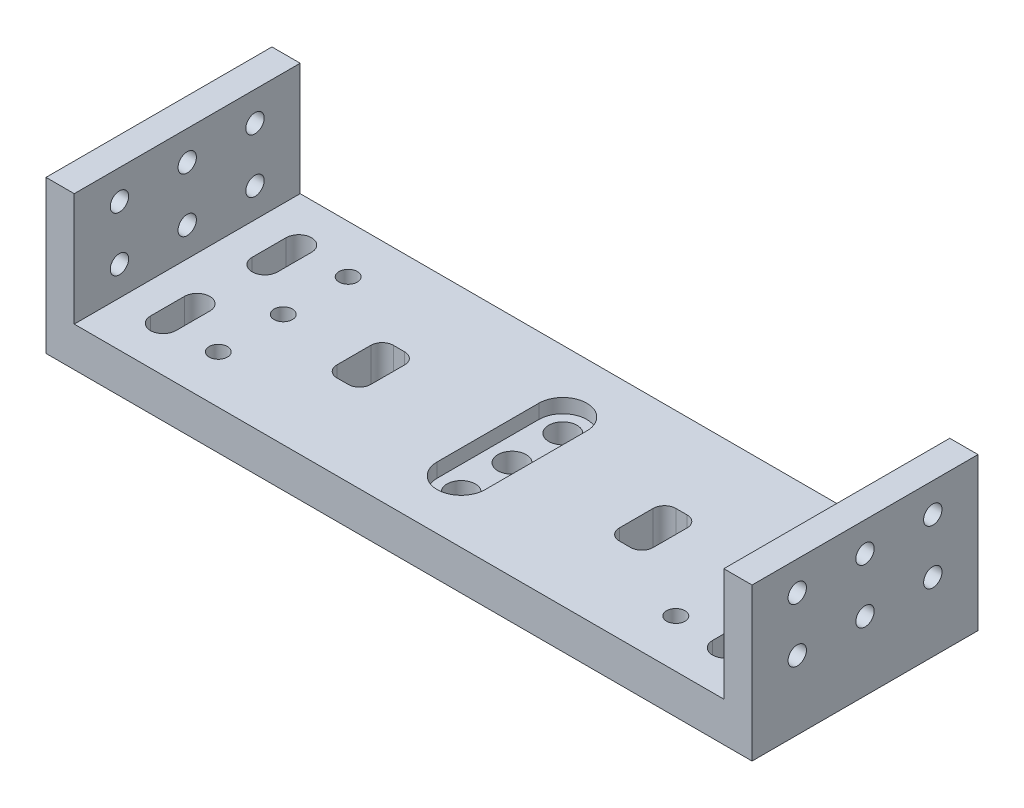
from build123d import *

# Parameters (mm, degrees)
ESBO_O1_W                  = 125
ESBO_O1_H                  = 40
BASE_DEPTH                 = 7
ESBO_O2_W                  = 5
ESBO_O2_H                  = 40
SUPORTE_LATERAL_DEPTH      = 20
ESBO_O3_R                  = 1.625
FURO_MOTOR_DEPTH           = 7
ESBO_O4_W                  = 6
ESBO_O4_H                  = 10
CORTE_EXTRUS_O2_DEPTH      = 69.60211367
CORTE_EXTRUS_O3_DEPTH      = 69.60211367
CORTE_EXTRUS_O3_DEPTH_BACK = 69.60211367
ESBO_O5_R                  = 2.5
CORTE_EXTRUS_O4_DEPTH      = 69.60211367
CORTE_EXTRUS_O5_DEPTH      = 2.5
ESBO_O9_R                  = 2.5
CORTE_EXTRUS_O6_DEPTH      = 70.372184628
CORTE_EXTRUS_O7_DEPTH      = 125.615408357
CORTE_EXTRUS_O7_DEPTH_BACK = 125.615408357
ESBO_O10_R                 = 1.625
FILETE1_R                  = 2


with BuildPart() as part:
    # Esboço1 → base (new body)
    with BuildSketch(Plane(origin=(0, 0, 0), x_dir=(1, 0, 0), z_dir=(0, 1, 0))):
        Rectangle(ESBO_O1_W, ESBO_O1_H)
    extrude(amount=BASE_DEPTH)

    # Esboço2 → suporte lateral (add)
    with BuildSketch(Plane(origin=(0, 7, 0), x_dir=(1, 0, 0), z_dir=(0, 1, 0))):
        with Locations((60, 0)):
            Rectangle(ESBO_O2_W, ESBO_O2_H)
        with Locations((-60, 0)):
            Rectangle(ESBO_O2_W, ESBO_O2_H)
    extrude(amount=SUPORTE_LATERAL_DEPTH)

    # Esboço3 → furo motor (cut)
    with BuildSketch(Plane(origin=(0, 7, 0), x_dir=(1, 0, 0), z_dir=(0, 1, 0))):
        with Locations(Location((-40.5, 0, 0), (0, 0, 270))):
            Circle(ESBO_O3_R)
        with Locations(Location((-40.5, 11.5, 0), (0, 0, 270))):
            Circle(ESBO_O3_R)
        with Locations(Location((-40.5, -11.5, 0), (0, 0, 270))):
            Circle(ESBO_O3_R)
        with Locations(Location((40.5, 11.5, 0), (0, 0, 270))):
            Circle(ESBO_O3_R)
        with Locations(Location((40.5, 0, 0), (0, 0, 270))):
            Circle(ESBO_O3_R)
        with Locations(Location((40.5, -11.5, 0), (0, 0, 270))):
            Circle(ESBO_O3_R)
    extrude(amount=-FURO_MOTOR_DEPTH, mode=Mode.SUBTRACT)

    # Esboço4 → Corte-extrusão2 (cut, through all)
    with BuildSketch(Plane(origin=(0, 7, 0), x_dir=(1, 0, 0), z_dir=(0, 1, 0))):
        with Locations((25, 0)):
            Rectangle(ESBO_O4_W, ESBO_O4_H)
        with Locations((-25, 0)):
            Rectangle(ESBO_O4_W, ESBO_O4_H)
    extrude(amount=-CORTE_EXTRUS_O2_DEPTH, mode=Mode.SUBTRACT)

    # Esboço5 → Corte-extrusão3 (cut, two sides: drawn at the far end of the back side and taken through both)
    with BuildSketch(Plane(origin=(0, 7, 0), x_dir=(1, 0, 0), z_dir=(0, 1, 0)).offset(-CORTE_EXTRUS_O3_DEPTH_BACK)):
        with Locations(Location((0, 9, 0), (0, 0, 270))):
            Circle(ESBO_O5_R)
        with Locations(Location((0, -9, 0), (0, 0, 270))):
            Circle(ESBO_O5_R)
    extrude(amount=CORTE_EXTRUS_O3_DEPTH + CORTE_EXTRUS_O3_DEPTH_BACK, mode=Mode.SUBTRACT)

    # Esboço7 → Corte-extrusão4 (cut, through all)
    with BuildSketch(Plane(origin=(0, 7, 0), x_dir=(1, 0, 0), z_dir=(0, 1, 0))):
        with BuildLine():
            ThreePointArc((52, 6), (49.75, 3.75), (47.5, 6))
            Line((47.5, 6), (47.5, 12))
            ThreePointArc((47.5, 12), (49.75, 14.25), (52, 12))
            Line((52, 12), (52, 6))
        make_face()
        with BuildLine():
            ThreePointArc((47.5, -6), (49.75, -3.75), (52, -6))
            Line((52, -6), (52, -12))
            ThreePointArc((52, -12), (49.75, -14.25), (47.5, -12))
            Line((47.5, -12), (47.5, -6))
        make_face()
        with BuildLine():
            Line((-52, -6), (-52, -12))
            ThreePointArc((-52, -12), (-49.75, -14.25), (-47.5, -12))
            Line((-47.5, -12), (-47.5, -6))
            ThreePointArc((-47.5, -6), (-49.75, -3.75), (-52, -6))
        make_face()
        with BuildLine():
            ThreePointArc((-47.5, 12), (-49.75, 14.25), (-52, 12))
            Line((-52, 12), (-52, 6))
            ThreePointArc((-52, 6), (-49.75, 3.75), (-47.5, 6))
            Line((-47.5, 6), (-47.5, 12))
        make_face()
    extrude(amount=-CORTE_EXTRUS_O4_DEPTH, mode=Mode.SUBTRACT)

    # Esboço8 → Corte-extrusão5 (cut)
    with BuildSketch(Plane(origin=(0, 7, 0), x_dir=(1, 0, 0), z_dir=(0, 1, 0))):
        with BuildLine():
            Line((4.25, 9), (4.25, -9))
            ThreePointArc((4.25, -9), (0, -13.25), (-4.25, -9))
            Line((-4.25, -9), (-4.25, 9))
            ThreePointArc((-4.25, 9), (0, 13.25), (4.25, 9))
        make_face()
    extrude(amount=-CORTE_EXTRUS_O5_DEPTH, mode=Mode.SUBTRACT)

    # Esboço9 → Corte-extrusão6 (cut, through all)
    with BuildSketch(Plane(origin=(0, 4.5, 0), x_dir=(1, 0, 0), z_dir=(0, 1, 0))):
        with Locations(Location((0, 0, 0), (0, 0, 270))):
            Circle(ESBO_O9_R)
    extrude(amount=-CORTE_EXTRUS_O6_DEPTH, mode=Mode.SUBTRACT)

    # Esboço10 → Corte-extrusão7 (cut, two sides: drawn at the far end of the back side and taken through both)
    with BuildSketch(Plane.ZY.offset(-57.5).offset(-CORTE_EXTRUS_O7_DEPTH_BACK)):
        with Locations((-12, 21.8)):
            Circle(ESBO_O10_R)
        with Locations((0, 21.8)):
            Circle(ESBO_O10_R)
        with Locations((12, 21.8)):
            Circle(ESBO_O10_R)
        with Locations((-12, 12.2)):
            Circle(ESBO_O10_R)
        with Locations((0, 12.2)):
            Circle(ESBO_O10_R)
        with Locations((12, 12.2)):
            Circle(ESBO_O10_R)
    extrude(amount=CORTE_EXTRUS_O7_DEPTH + CORTE_EXTRUS_O7_DEPTH_BACK, mode=Mode.SUBTRACT)

    # Filete1
    filete1_edges = [part.edges().sort_by_distance(p)[0] for p in [
        (22, 3.5, 5),
        (22, 3.5, -5),
        (28, 3.5, -5),
        (28, 3.5, 5),
        (-28, 3.5, 5),
        (-28, 3.5, -5),
        (-22, 3.5, -5),
        (-22, 3.5, 5),
    ]]
    fillet(filete1_edges, radius=FILETE1_R)


solid = part.part
